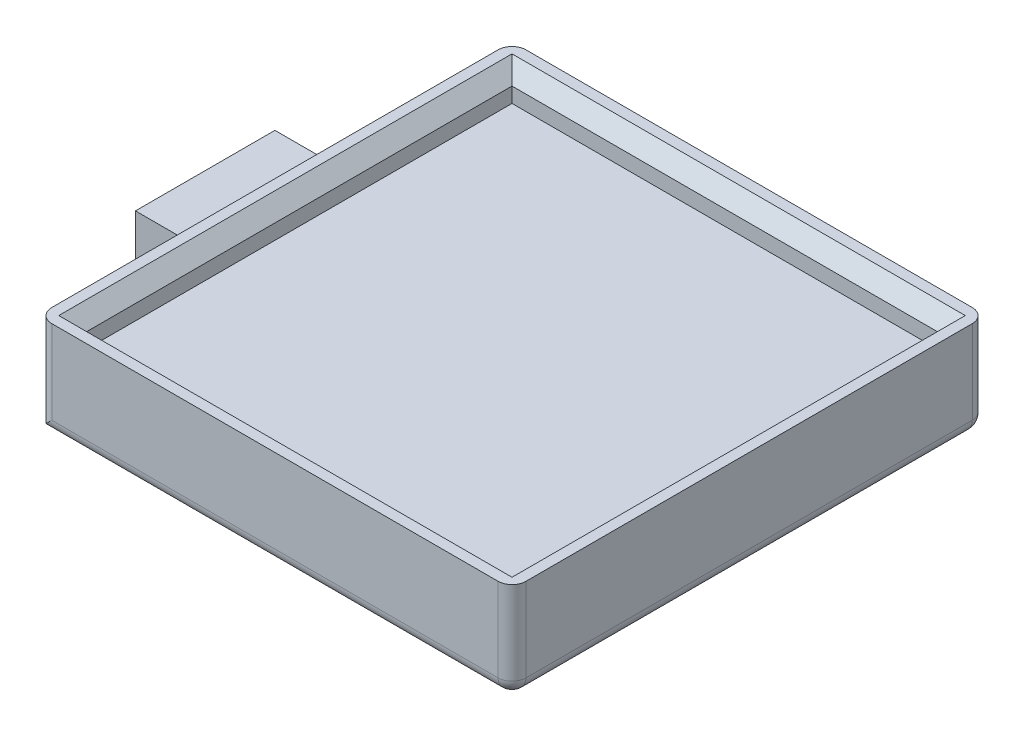
from build123d import *

# Parameters (mm, degrees)
EXTRUDE_1_DEPTH     = 5
SKETCH_2_W          = 34
SKETCH_2_H          = 34
EXTRUDE_2_DEPTH     = 2
SKETCH_3_W          = 30.5
SKETCH_3_H          = 30.5
CUT_EXTRUDE_2_DEPTH = 2.08
CHAMFER_1_SIZE      = 1
FILLET_2_R          = 1


with BuildPart() as part:
    # 草图1 → 凸台-拉伸1 (new body)
    with BuildSketch(Plane(origin=(0, 0, 0), x_dir=(1, 0, 0), z_dir=(0, 1, 0))):
        Polygon((0, 10), (5, 10), (5, 22), (39, 22), (39, -12), (5, -12), (5, 0), (0, 0), align=None)
    extrude(amount=EXTRUDE_1_DEPTH)

    # 草图2 → 凸台-拉伸2 (add)
    with BuildSketch(Plane(origin=(0, 5, 0), x_dir=(1, 0, 0), z_dir=(0, 1, 0))):
        with Locations((22, 5)):
            Rectangle(SKETCH_2_W, SKETCH_2_H)
    extrude(amount=EXTRUDE_2_DEPTH)

    # 草图3 → 切除-拉伸2 (cut)
    with BuildSketch(Plane(origin=(0, 7, 0), x_dir=(1, 0, 0), z_dir=(0, 1, 0))):
        with Locations((22, 5)):
            Rectangle(SKETCH_3_W, SKETCH_3_H)
    extrude(amount=-CUT_EXTRUDE_2_DEPTH, mode=Mode.SUBTRACT)

    # 倒角1
    chamfer_1_edges = [part.edges().sort_by_distance(p)[0] for p in [
        (22, 7, -20.25),
        (37.25, 7, -5),
        (22, 7, 10.25),
        (6.75, 7, -5),
    ]]
    chamfer(chamfer_1_edges, length=CHAMFER_1_SIZE)

    # 圆角2
    fillet_2_edges = [part.edges().sort_by_distance(p)[0] for p in [
        (5, 3.5, 12),
        (39, 3.5, 12),
        (39, 3.5, -22),
        (5, 3.5, -22),
        (22, 0, 12),
        (39, 0, -5),
        (22, 0, -22),
    ]]
    fillet(fillet_2_edges, radius=FILLET_2_R)


solid = part.part
